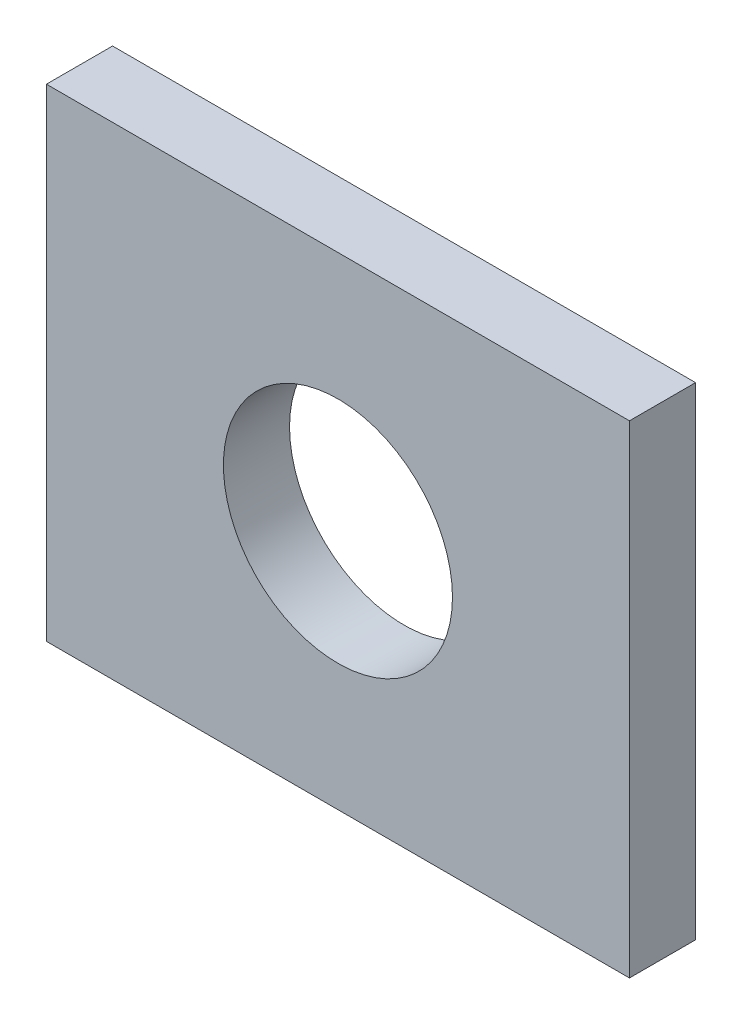
from build123d import *

# Parameters (mm, degrees)
SKETCH1_W           = 56
SKETCH1_H           = 46.35
BOSS_EXTRUDE1_DEPTH = 6.35
CUT_EXTRUDE1_REACH  = 66.074
SKETCH3_R           = 11


with BuildPart() as part:
    # Sketch1 → Boss-Extrude1 (new body)
    with BuildSketch(Plane.XY):
        with Locations((21.65, 16.825)):
            Rectangle(SKETCH1_W, SKETCH1_H)
    extrude(amount=BOSS_EXTRUDE1_DEPTH)

    # Sketch3 → Cut-Extrude1 (cut, up to next)
    with BuildSketch(Plane.XY.offset(6.35), mode=Mode.PRIVATE) as cut_extrude1_sk1:
        with Locations((21.65, 16.825)):
            Circle(SKETCH3_R)
    cut_extrude1_tool1 = extrude(cut_extrude1_sk1.sketch, amount=-CUT_EXTRUDE1_REACH, mode=Mode.PRIVATE) & part.part
    add(cut_extrude1_tool1.solids().sort_by_distance((21.65, 16.825, 6.35))[0], mode=Mode.SUBTRACT)


solid = part.part
